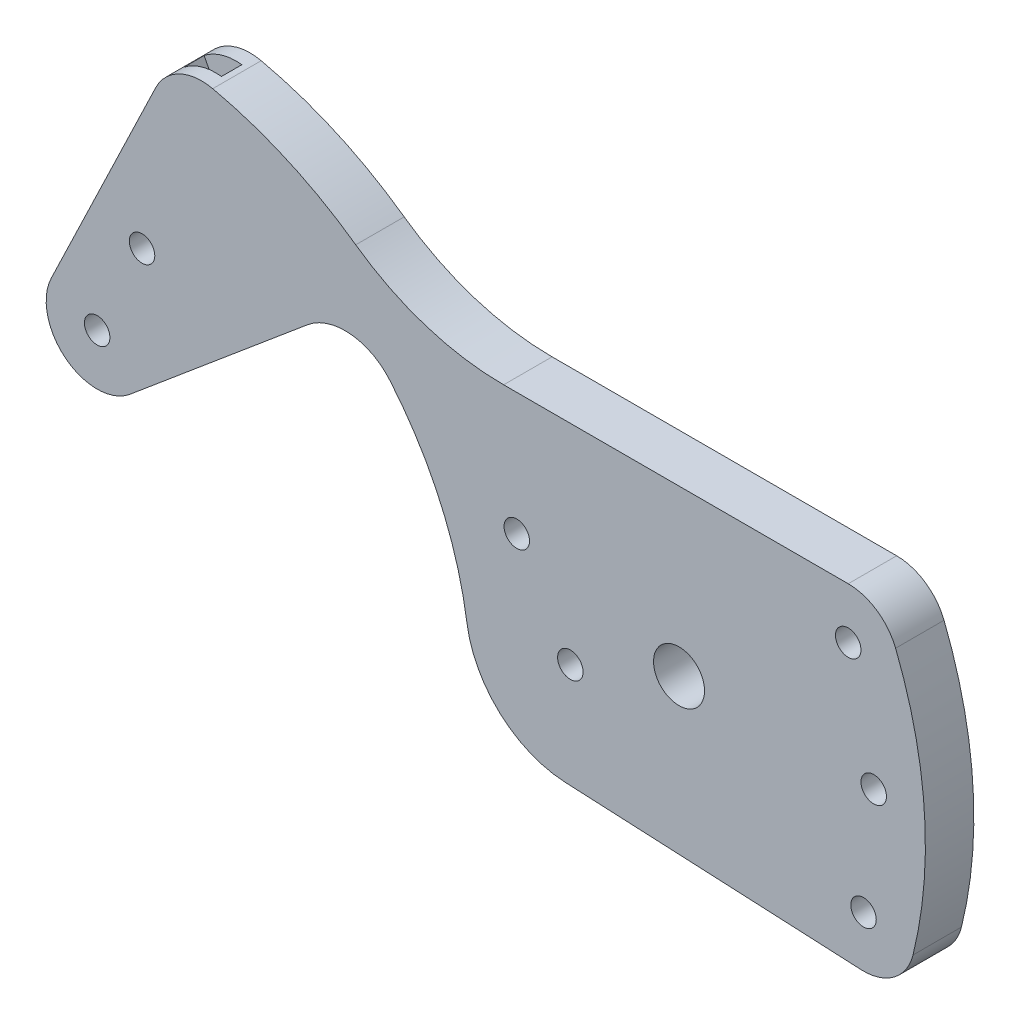
from build123d import *

# Parameters (mm, degrees)
SKETCH1_R           = 5
SKETCH1_R_2         = 2.5
BOSS_EXTRUDE1_DEPTH = 4.75
CUT_EXTRUDE1_DEPTH  = 2


with BuildPart() as part:
    # Sketch1 → Boss-Extrude1 (new, symmetric)
    with BuildSketch(Plane.XY):
        with BuildLine():
            Line((-22.308767332, -29.181670657), (35.698943118, -31.988315456))
            ThreePointArc((35.698943118, -31.988315456), (42.1516901, -30.02280497), (45.888257007, -24.406823948))
            ThreePointArc((45.888257007, -24.406823948), (48.128157677, 1.060560267), (42.475146865, 25.993435805))
            ThreePointArc((42.475146865, 25.993435805), (38.797626972, 30.574489653), (33.182217728, 32.3))
            Line((33.182217728, 32.3), (-34.397529085, 32.3))
            ThreePointArc((-34.397529085, 32.3), (-49.622555092, 34.67439152), (-63.401574193, 41.572056677))
            ThreePointArc((-63.401574193, 41.572056677), (-76.799263642, 49.225759558), (-91.448521696, 54.071013816))
            ThreePointArc((-91.448521696, 54.071013816), (-97.990041102, 53.309279516), (-102.639296293, 48.644931604))
            Line((-102.639296293, 48.644931604), (-123.129936653, 6.033713582))
            ThreePointArc((-123.129936653, 6.033713582), (-120.252485213, -6.197177966), (-107.689906175, -5.960444431))
            Line((-107.689906175, -5.960444431), (-72.864818345, 23.261273923))
            ThreePointArc((-72.864818345, 23.261273923), (-64.470178387, 25.908093735), (-56.662687309, 21.843771132))
            ThreePointArc((-56.662687309, 21.843771132), (-46.805355693, 6.125218695), (-41.605017691, -11.684788659))
            ThreePointArc((-41.605017691, -11.684788659), (-35.091884298, -23.890622031), (-22.308767332, -29.181670657))
        make_face()
        Circle(SKETCH1_R, mode=Mode.SUBTRACT)
        with Locations((36.182217728, -22)):
            Circle(SKETCH1_R_2, mode=Mode.SUBTRACT)
        with Locations((-21.317782272, -8.7)):
            Circle(SKETCH1_R_2, mode=Mode.SUBTRACT)
        with Locations((38.182217728, -0.1)):
            Circle(SKETCH1_R_2, mode=Mode.SUBTRACT)
        with Locations((33.182217728, 22.3)):
            Circle(SKETCH1_R_2, mode=Mode.SUBTRACT)
        with Locations((-31.817782272, 8.3)):
            Circle(SKETCH1_R_2, mode=Mode.SUBTRACT)
        with Locations((-105.317782272, 20)):
            Circle(SKETCH1_R_2, mode=Mode.SUBTRACT)
        with Locations((-114.117782272, 1.7)):
            Circle(SKETCH1_R_2, mode=Mode.SUBTRACT)
    extrude(amount=BOSS_EXTRUDE1_DEPTH, both=True)

    # Sketch2 → Cut-Extrude1 (cut, symmetric)
    with BuildSketch(Plane.XY):
        with BuildLine():
            Line((-78.227129447, 18.761760655), (-91.668909505, 44.876871439))
            Line((-91.668909505, 44.876871439), (-92.486661389, 54.245970368))
            ThreePointArc((-92.486661389, 54.245970368), (-96.402275052, 53.918435936), (-99.889427329, 52.10761343))
            Line((-99.889427329, 52.10761343), (-95.58537432, 43.745564604))
            Line((-95.58537432, 43.745564604), (-92.369017313, 6.895307763))
            Line((-92.369017313, 6.895307763), (-78.227129447, 18.761760655))
        make_face()
    extrude(amount=CUT_EXTRUDE1_DEPTH, both=True, mode=Mode.SUBTRACT)


solid = part.part
